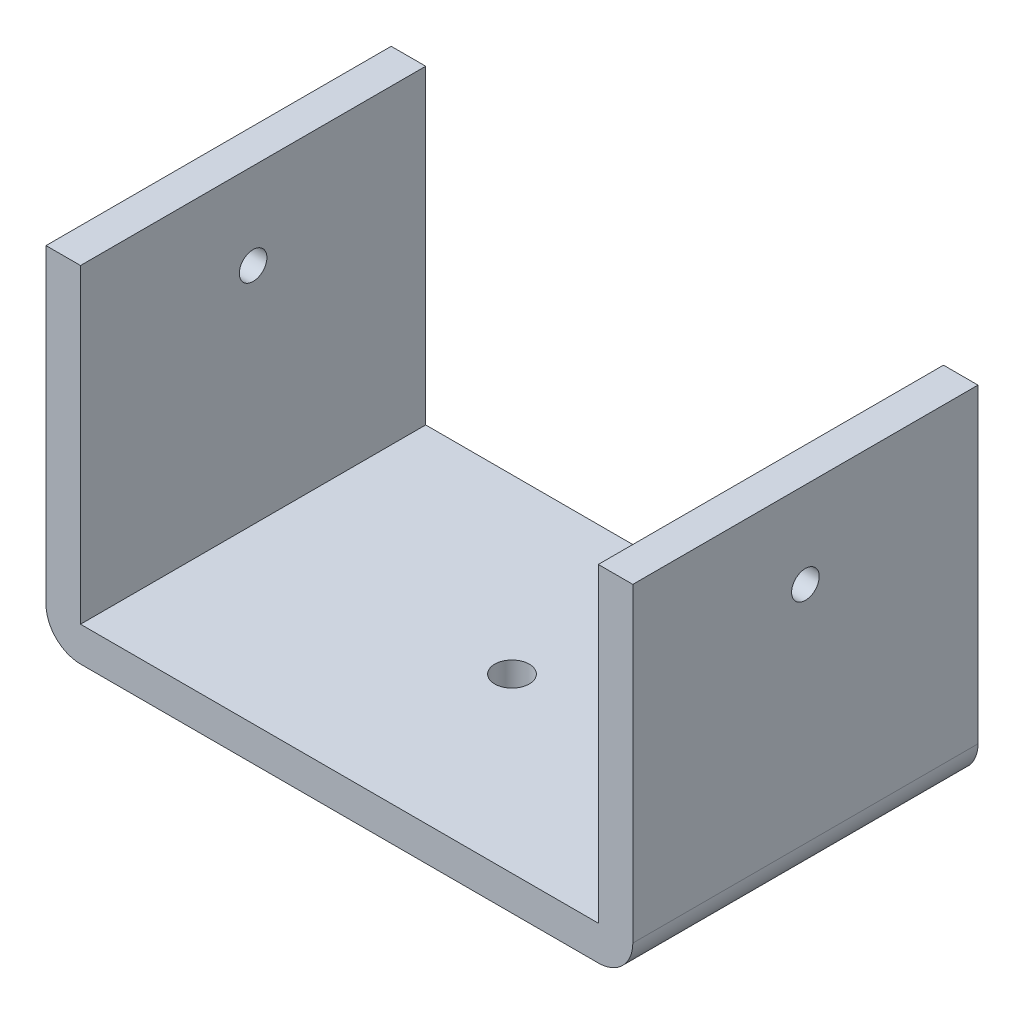
from build123d import *

# Parameters (mm, degrees)
SKETCH1_W           = 75
SKETCH1_H           = 10
BOSS_EXTRUDE1_DEPTH = 100
SKETCH2_R           = 5
CUT_EXTRUDE1_DEPTH  = 10
FILLET1_R           = 10
SKETCH3_R           = 4
CUT_EXTRUDE2_DEPTH  = 192


with BuildPart() as part:
    # Sketch1 → Boss-Extrude1 (new body)
    with BuildSketch(Plane.XY):
        with Locations((112.5, -5)):
            Rectangle(SKETCH1_W, SKETCH1_H)
        with Locations((37.5, -5)):
            Rectangle(SKETCH1_W, SKETCH1_H)
        Polygon((150, 0), (150, -10), (160, -10), (160, 90), (150, 90), align=None)
        Polygon((-10, -10), (0, -10), (0, 0), (0, 90), (-10, 90), align=None)
    extrude(amount=BOSS_EXTRUDE1_DEPTH)

    # Sketch2 → Cut-Extrude1 (cut)
    with BuildSketch(Plane(origin=(0, 0, 0), x_dir=(1, 0, 0), z_dir=(0, 1, 0))):
        with Locations(Location((75, -50, 0), (0, 0, 270))):
            Circle(SKETCH2_R)
    extrude(amount=-CUT_EXTRUDE1_DEPTH, mode=Mode.SUBTRACT)

    # Fillet1
    fillet1_edges = [part.edges().sort_by_distance(p)[0] for p in [
        (160, -10, 50),
        (-10, -10, 50),
    ]]
    fillet(fillet1_edges, radius=FILLET1_R)

    # Sketch3 → Cut-Extrude2 (cut)
    with BuildSketch(Plane.ZY.offset(10)):
        with Locations((50, 65)):
            Circle(SKETCH3_R)
    extrude(amount=-CUT_EXTRUDE2_DEPTH, mode=Mode.SUBTRACT)


solid = part.part
